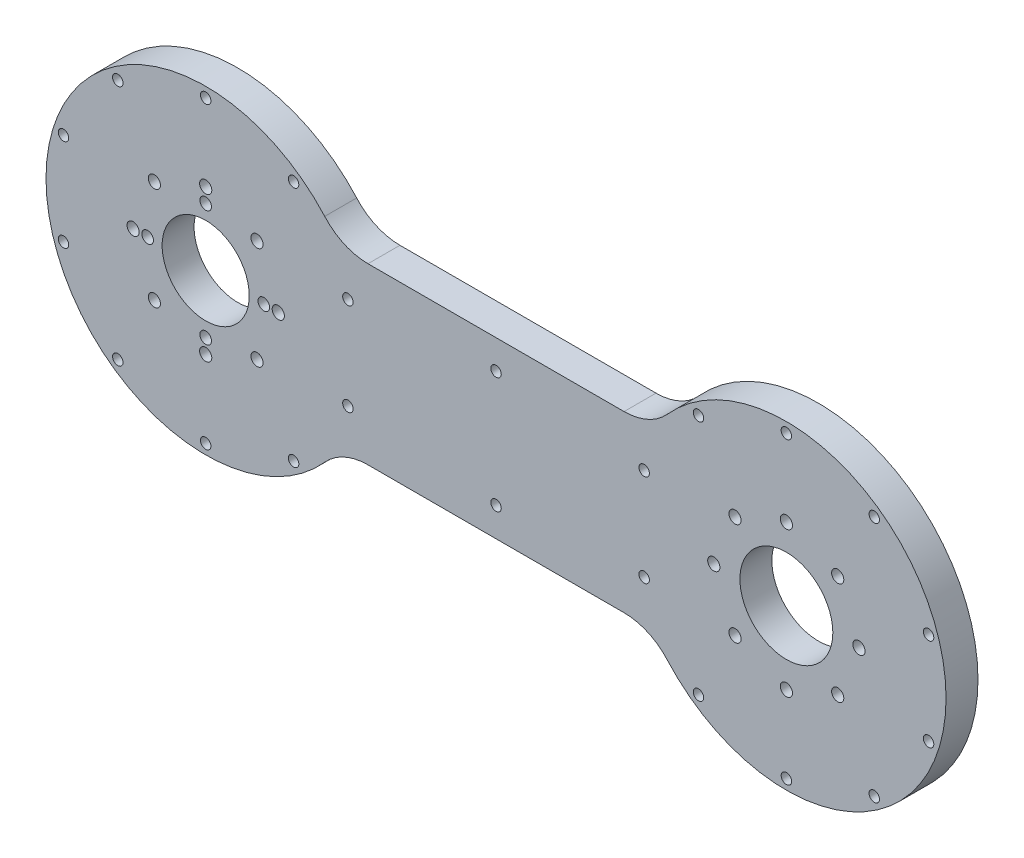
from build123d import *

# Parameters (mm, degrees)
ESQUISSE1_W             = 320
ESQUISSE1_H             = 120
ESQUISSE1_R             = 16
ESQUISSE1_R_2           = 15
ESQUISSE1_R_3           = 2
BOSS_EXTRU_1_DEPTH      = 11
ESQUISSE2_R             = 2.1
ENL_V_MAT_EXTRU_1_DEPTH = 11
ESQUISSE3_OUTSIDE_W     = 390.388
ESQUISSE3_OUTSIDE_H     = 190.388
ENL_V_MAT_EXTRU_2_DEPTH = 268.05991837
CONG_1_R                = 20
ESQUISSE4_R             = 1.8
ENL_V_MAT_EXTRU_3_DEPTH = 262.095767871
ESQUISSE5_R             = 1.8
ENL_V_MAT_EXTRU_4_DEPTH = 262.095767871


with BuildPart() as part:
    # Esquisse1 → Boss.-Extru.1 (new body)
    with BuildSketch(Plane.XY):
        with Locations((-100, 0)):
            Rectangle(ESQUISSE1_W, ESQUISSE1_H)
        Circle(ESQUISSE1_R, mode=Mode.SUBTRACT)
        with Locations((-200, 0)):
            Circle(ESQUISSE1_R_2, mode=Mode.SUBTRACT)
        with Locations((-200, 20)):
            Circle(ESQUISSE1_R_3, mode=Mode.SUBTRACT)
        with Locations((-180, 0)):
            Circle(ESQUISSE1_R_3, mode=Mode.SUBTRACT)
        with Locations((-200, -20)):
            Circle(ESQUISSE1_R_3, mode=Mode.SUBTRACT)
        with Locations((-220, 0)):
            Circle(ESQUISSE1_R_3, mode=Mode.SUBTRACT)
    extrude(amount=BOSS_EXTRU_1_DEPTH)

    # Esquisse2 → Enlèv. mat.-Extru.1 (cut)
    with BuildSketch(Plane.XY.offset(11)):
        with Locations((-200, 25)):
            Circle(ESQUISSE2_R)
        with Locations((-182.32233047, 17.67766953)):
            Circle(ESQUISSE2_R)
        with Locations((-175, 0)):
            Circle(ESQUISSE2_R)
        with Locations((-182.32233047, -17.67766953)):
            Circle(ESQUISSE2_R)
        with Locations((-200, -25)):
            Circle(ESQUISSE2_R)
        with Locations((-217.67766953, -17.67766953)):
            Circle(ESQUISSE2_R)
        with Locations((-225, 0)):
            Circle(ESQUISSE2_R)
        with Locations((-217.67766953, 17.67766953)):
            Circle(ESQUISSE2_R)
        with Locations((0, 25)):
            Circle(ESQUISSE2_R)
        with Locations((17.67766953, 17.67766953)):
            Circle(ESQUISSE2_R)
        with Locations((25, 0)):
            Circle(ESQUISSE2_R)
        with Locations((17.67766953, -17.67766953)):
            Circle(ESQUISSE2_R)
        with Locations((0, -25)):
            Circle(ESQUISSE2_R)
        with Locations((-17.67766953, -17.67766953)):
            Circle(ESQUISSE2_R)
        with Locations((-25, 0)):
            Circle(ESQUISSE2_R)
        with Locations((-17.67766953, 17.67766953)):
            Circle(ESQUISSE2_R)
    extrude(amount=-ENL_V_MAT_EXTRU_1_DEPTH, mode=Mode.SUBTRACT)

    # Esquisse3 outside → Enlèv. mat.-Extru.2 (cut, through all)
    with BuildSketch(Plane.XY.offset(11)):
        with Locations((-100, 0)):
            Rectangle(ESQUISSE3_OUTSIDE_W, ESQUISSE3_OUTSIDE_H)
        with BuildLine():
            Line((-153.902277714, 30), (-46.097722286, 30))
            ThreePointArc((-46.097722286, 30), (55, 0), (-46.097722286, -30))
            Line((-46.097722286, -30), (-153.902277714, -30))
            ThreePointArc((-153.902277714, -30), (-255, 0), (-153.902277714, 30))
        make_face(mode=Mode.SUBTRACT)
    extrude(amount=-ENL_V_MAT_EXTRU_2_DEPTH, mode=Mode.SUBTRACT)

    # Congé1
    cong_1_edges = [part.edges().sort_by_distance(p)[0] for p in [
        (-153.902277714, 30, 5.5),
        (-46.097722286, 30, 5.5),
        (-46.097722286, -30, 5.5),
        (-153.902277714, -30, 5.5),
    ]]
    fillet(cong_1_edges, radius=CONG_1_R)

    # Esquisse4 → Enlèv. mat.-Extru.3 (cut, through all)
    with BuildSketch(Plane.XY.offset(11)):
        with Locations((-200, 51.5)):
            Circle(ESQUISSE4_R)
        with Locations((-169.729059507, 41.66437521)):
            Circle(ESQUISSE4_R)
        with Locations((-151.020589411, 15.91437521)):
            Circle(ESQUISSE4_R)
        with Locations((-151.020589411, -15.91437521)):
            Circle(ESQUISSE4_R)
        with Locations((-169.729059507, -41.66437521)):
            Circle(ESQUISSE4_R)
        with Locations((-200, -51.5)):
            Circle(ESQUISSE4_R)
        with Locations((-230.270940493, -41.66437521)):
            Circle(ESQUISSE4_R)
        with Locations((-248.979410589, -15.91437521)):
            Circle(ESQUISSE4_R)
        with Locations((-248.979410589, 15.91437521)):
            Circle(ESQUISSE4_R)
        with Locations((-230.270940493, 41.66437521)):
            Circle(ESQUISSE4_R)
        with Locations(Location((30.270940493, 41.66437521, 0), (0, 0, 180))):
            Circle(ESQUISSE4_R)
        with Locations(Location((48.979410589, 15.91437521, 0), (0, 0, 180))):
            Circle(ESQUISSE4_R)
        with Locations(Location((48.979410589, -15.91437521, 0), (0, 0, 180))):
            Circle(ESQUISSE4_R)
        with Locations(Location((30.270940493, -41.66437521, 0), (0, 0, 180))):
            Circle(ESQUISSE4_R)
        with Locations(Location((0, -51.5, 0), (0, 0, 180))):
            Circle(ESQUISSE4_R)
        with Locations(Location((-30.270940493, -41.66437521, 0), (0, 0, 180))):
            Circle(ESQUISSE4_R)
        with Locations(Location((-48.979410589, -15.91437521, 0), (0, 0, 180))):
            Circle(ESQUISSE4_R)
        with Locations(Location((-48.979410589, 15.91437521, 0), (0, 0, 180))):
            Circle(ESQUISSE4_R)
        with Locations(Location((-30.270940493, 41.66437521, 0), (0, 0, 180))):
            Circle(ESQUISSE4_R)
        with Locations(Location((0, 51.5, 0), (0, 0, 180))):
            Circle(ESQUISSE4_R)
    extrude(amount=-ENL_V_MAT_EXTRU_3_DEPTH, mode=Mode.SUBTRACT)

    # Esquisse5 → Enlèv. mat.-Extru.4 (cut, through all)
    with BuildSketch(Plane.XY.offset(11)):
        with Locations((-100, 20)):
            Circle(ESQUISSE5_R)
        with Locations((-100, -20)):
            Circle(ESQUISSE5_R)
    extrude(amount=-ENL_V_MAT_EXTRU_4_DEPTH, mode=Mode.SUBTRACT)


solid = part.part
